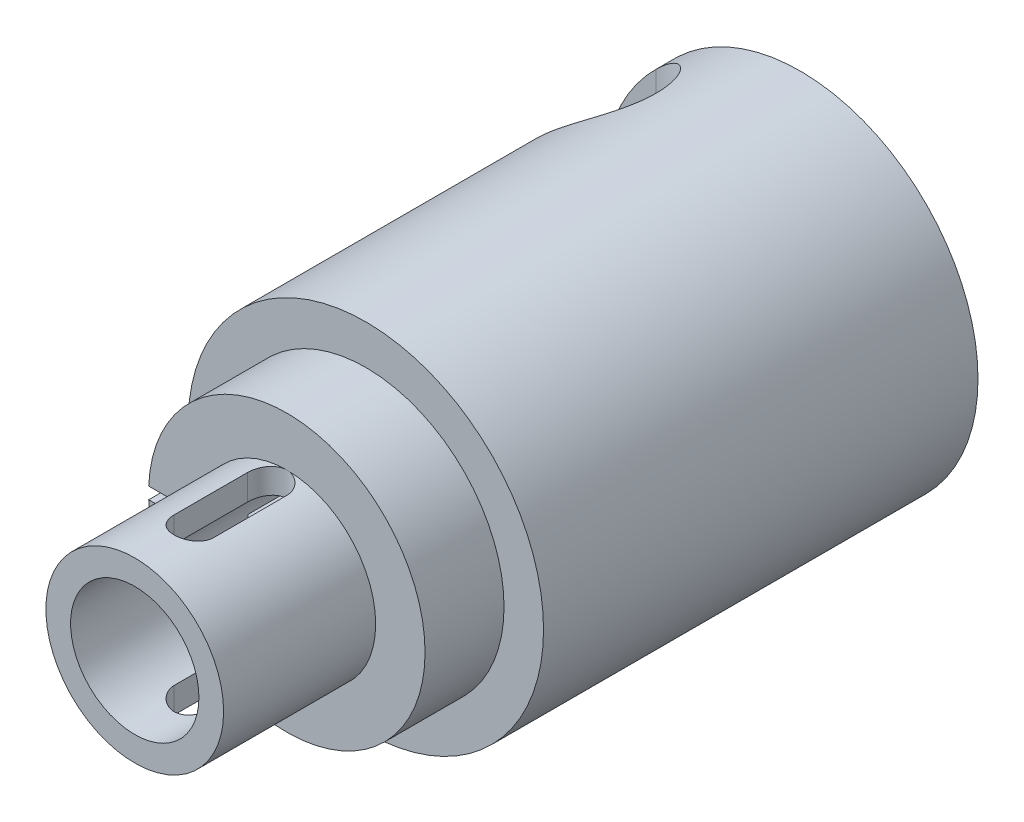
from build123d import *

# Parameters (mm, degrees)
SKETCH_1_R               = 4.5
EXTRUDE_1_DEPTH          = 7.7
SKETCH_3_R               = 7
EXTRUDE_2_DEPTH          = 4
CUT_EXTRUDE_3_DEPTH      = 13.541531007
CUT_EXTRUDE_3_DEPTH_BACK = 13.541531007
SKETCH_7_R               = 9
EXTRUDE_4_DEPTH          = 22
SKETCH_5_R               = 3.25
CUT_EXTRUDE_2_DEPTH      = 26
SKETCH_8_R               = 4
CUT_EXTRUDE_4_DEPTH      = 8
CUT_EXTRUDE_5_DEPTH      = 0.3
CUT_EXTRUDE_5_DEPTH_BACK = 0.3
SKETCH_9_R               = 40
CUT_EXTRUDE_6_DEPTH      = 30.82029519
SKETCH_11_R              = 1.5
CUT_EXTRUDE_7_DEPTH      = 2.2
SKETCH_12_R              = 1.25
CUT_EXTRUDE_8_DEPTH      = 30.820295258


with BuildPart() as part:
    # Эскиз1 → Бобышка-Вытянуть1 (new body)
    with BuildSketch(Plane.XY):
        with Locations(Location((0, 0, 0), (0, 0, 180))):
            Circle(SKETCH_1_R)
    extrude(amount=EXTRUDE_1_DEPTH)

    # Эскиз3 → Бобышка-Вытянуть2 (add)
    with BuildSketch(Plane(origin=(0, 0, 0), x_dir=(-1, 0, 0), z_dir=(0, 0, -1))):
        Circle(SKETCH_3_R)
    extrude(amount=EXTRUDE_2_DEPTH)

    # Эскиз6 → Вырез-Вытянуть3 (cut, two sides: drawn at the far end of the back side and taken through both)
    with BuildSketch(Plane(origin=(0, 0, 0), x_dir=(1, 0, 0), z_dir=(0, 1, 0)).offset(-CUT_EXTRUDE_3_DEPTH_BACK)):
        with BuildLine():
            Line((-1, -4.7), (-1, -1))
            ThreePointArc((-1, -1), (0, 0), (1, -1))
            Line((1, -1), (1, -4.7))
            ThreePointArc((1, -4.7), (0, -5.7), (-1, -4.7))
        make_face()
    extrude(amount=CUT_EXTRUDE_3_DEPTH + CUT_EXTRUDE_3_DEPTH_BACK, mode=Mode.SUBTRACT)

    # Эскиз7 → Бобышка-Вытянуть4 (add)
    with BuildSketch(Plane(origin=(0, 0, -4), x_dir=(-1, 0, 0), z_dir=(0, 0, -1))):
        Circle(SKETCH_7_R)
    extrude(amount=EXTRUDE_4_DEPTH)

    # Эскиз5 → Вырез-Вытянуть2 (cut)
    with BuildSketch(Plane.XY.offset(7.7)):
        Circle(SKETCH_5_R)
    extrude(amount=-CUT_EXTRUDE_2_DEPTH, mode=Mode.SUBTRACT)

    # Эскиз8 → Вырез-Вытянуть4 (cut)
    with BuildSketch(Plane(origin=(0, 0, -26), x_dir=(-1, 0, 0), z_dir=(0, 0, -1))):
        Circle(SKETCH_8_R)
    extrude(amount=-CUT_EXTRUDE_4_DEPTH, mode=Mode.SUBTRACT)

    # Эскиз9 → Вырез-Вытянуть5 (cut, two sides: drawn at the far end of the back side and taken through both)
    with BuildSketch(Plane(origin=(0, 0, 0), x_dir=(1, 0, 0), z_dir=(0, 1, 0)).offset(-CUT_EXTRUDE_5_DEPTH_BACK)):
        with Locations((-33, 28)):
            Circle(SKETCH_9_R)
    extrude(amount=CUT_EXTRUDE_5_DEPTH + CUT_EXTRUDE_5_DEPTH_BACK, mode=Mode.SUBTRACT)

    # Эскиз10 → Вырез-Вытянуть6 (cut, through all)
    with BuildSketch(Plane(origin=(0, 2.5, 0), x_dir=(1, 0, 0), z_dir=(0, 1, 0))):
        with BuildLine():
            Line((-6.3, 25), (-11.651726046, 25))
            Line((-11.651726046, 25), (-11.651726046, 19))
            Line((-11.651726046, 19), (-6.3, 19))
            ThreePointArc((-6.3, 19), (-3.3, 22), (-6.3, 25))
        make_face()
    extrude(amount=CUT_EXTRUDE_6_DEPTH, mode=Mode.SUBTRACT)

    # Эскиз11 → Вырез-Вытянуть7 (cut)
    with BuildSketch(Plane(origin=(0, 2.5, 0), x_dir=(1, 0, 0), z_dir=(0, 1, 0))):
        with Locations(Location((-6.3, 22, 0), (0, 0, 270))):
            Circle(SKETCH_11_R)
    extrude(amount=-CUT_EXTRUDE_7_DEPTH, mode=Mode.SUBTRACT)

    # Эскиз12 → Вырез-Вытянуть8 (cut, through all)
    with BuildSketch(Plane(origin=(0, 2.5, 0), x_dir=(1, 0, 0), z_dir=(0, 1, 0))):
        with Locations(Location((-6.3, 22, 0), (0, 0, 270))):
            Circle(SKETCH_12_R)
    extrude(amount=-CUT_EXTRUDE_8_DEPTH, mode=Mode.SUBTRACT)


solid = part.part
